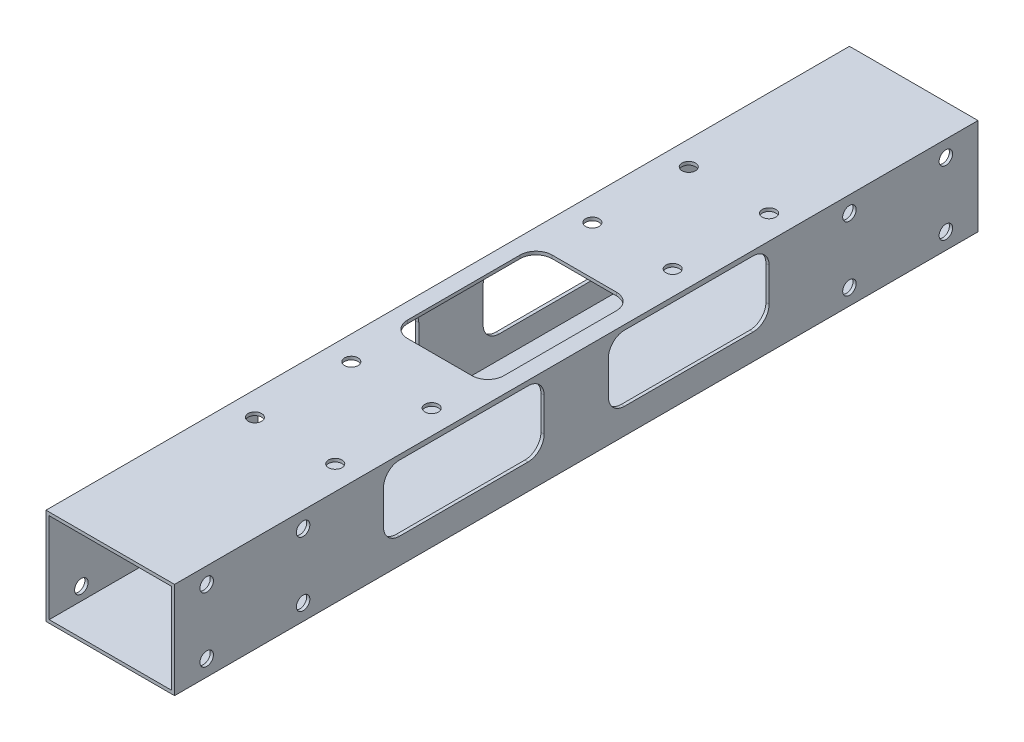
from build123d import *

# Parameters (mm, degrees)
SKETCH_1_W               = 40
SKETCH_1_H               = 30
SKETCH_1_W_2             = 38
SKETCH_1_H_2             = 28
EXTRUDE_1_DEPTH          = 250
CUT_EXTRUDE_1_DEPTH      = 252.246890528
CUT_EXTRUDE_1_DEPTH_BACK = 252.246890528
SKETCH_2_R               = 2.1
CUT_EXTRUDE_START        = 15
SKETCH_3_R               = 2.1
CUT_EXTRUDE_2_DEPTH      = 29
CUT_EXTRUDE_3_DEPTH      = 252.246890528
CUT_EXTRUDE_3_DEPTH_BACK = 252.246890528


with BuildPart() as part:
    # 草图1 → 凸台-拉伸1 (new body)
    with BuildSketch(Plane.XY):
        Rectangle(SKETCH_1_W, SKETCH_1_H)
        Rectangle(SKETCH_1_W_2, SKETCH_1_H_2, mode=Mode.SUBTRACT)
    extrude(amount=EXTRUDE_1_DEPTH)

    # 草图2 → 切除-拉伸1 (cut, two sides: drawn at the far end of the back side and taken through both)
    with BuildSketch(Plane(origin=(0, 0, 0), x_dir=(0, 0, -1), z_dir=(1, 0, 0)).offset(-CUT_EXTRUDE_1_DEPTH_BACK)):
        with Locations((-210, 10)):
            Circle(SKETCH_2_R)
        with Locations((-240, 10)):
            Circle(SKETCH_2_R)
        with Locations((-210, -10)):
            Circle(SKETCH_2_R)
        with Locations((-240, -10)):
            Circle(SKETCH_2_R)
        with Locations((-10, -10)):
            Circle(SKETCH_2_R)
        with Locations((-40, -10)):
            Circle(SKETCH_2_R)
        with Locations((-10, 10)):
            Circle(SKETCH_2_R)
        with Locations((-40, 10)):
            Circle(SKETCH_2_R)
    extrude(amount=CUT_EXTRUDE_1_DEPTH + CUT_EXTRUDE_1_DEPTH_BACK, mode=Mode.SUBTRACT)

    # 草图3 → 切除-拉伸2 (cut)
    with BuildSketch(Plane(origin=(0, 0, 0), x_dir=(1, 0, 0), z_dir=(0, 1, 0)).offset(CUT_EXTRUDE_START)):
        with Locations(Location((-12.5, -87.5, 0), (0, 0, 90))):
            Circle(SKETCH_3_R)
        with Locations(Location((12.5, -87.5, 0), (0, 0, 90))):
            Circle(SKETCH_3_R)
        with Locations(Location((-12.5, -57.5, 0), (0, 0, 90))):
            Circle(SKETCH_3_R)
        with Locations(Location((12.5, -57.5, 0), (0, 0, 90))):
            Circle(SKETCH_3_R)
        with Locations(Location((12.5, -192.5, 0), (0, 0, 90))):
            Circle(SKETCH_3_R)
        with Locations(Location((-12.5, -192.5, 0), (0, 0, 90))):
            Circle(SKETCH_3_R)
        with Locations(Location((12.5, -162.5, 0), (0, 0, 90))):
            Circle(SKETCH_3_R)
        with Locations(Location((-12.5, -162.5, 0), (0, 0, 90))):
            Circle(SKETCH_3_R)
        with BuildLine():
            Line((-10, -147.5), (10, -147.5))
            ThreePointArc((10, -147.5), (13.535533906, -146.035533906), (15, -142.5))
            Line((15, -142.5), (15, -107.5))
            ThreePointArc((15, -107.5), (13.535533906, -103.964466094), (10, -102.5))
            Line((10, -102.5), (-10, -102.5))
            ThreePointArc((-10, -102.5), (-13.535533906, -103.964466094), (-15, -107.5))
            Line((-15, -107.5), (-15, -142.5))
            ThreePointArc((-15, -142.5), (-13.535533906, -146.035533906), (-10, -147.5))
        make_face()
    extrude(amount=-CUT_EXTRUDE_2_DEPTH, mode=Mode.SUBTRACT)

    # 草图4 → 切除-拉伸3 (cut, two sides: drawn at the far end of the back side and taken through both)
    with BuildSketch(Plane(origin=(0, 0, 0), x_dir=(0, 0, -1), z_dir=(1, 0, 0)).offset(-CUT_EXTRUDE_3_DEPTH_BACK)):
        with BuildLine():
            Line((-180, -7), (-140, -7))
            ThreePointArc((-140, -7), (-136.464466094, -5.535533906), (-135, -2))
            Line((-135, -2), (-135, 8.5))
            ThreePointArc((-135, 8.5), (-136.464466094, 12.035533906), (-140, 13.5))
            Line((-140, 13.5), (-180, 13.5))
            ThreePointArc((-180, 13.5), (-183.535533906, 12.035533906), (-185, 8.5))
            Line((-185, 8.5), (-185, -2))
            ThreePointArc((-185, -2), (-183.535533906, -5.535533906), (-180, -7))
        make_face()
        with BuildLine():
            Line((-115, -2), (-115, 8.5))
            ThreePointArc((-115, 8.5), (-113.535533906, 12.035533906), (-110, 13.5))
            Line((-110, 13.5), (-70, 13.5))
            ThreePointArc((-70, 13.5), (-66.464466094, 12.035533906), (-65, 8.5))
            Line((-65, 8.5), (-65, -2))
            ThreePointArc((-65, -2), (-66.464466094, -5.535533906), (-70, -7))
            Line((-70, -7), (-110, -7))
            ThreePointArc((-110, -7), (-113.535533906, -5.535533906), (-115, -2))
        make_face()
    extrude(amount=CUT_EXTRUDE_3_DEPTH + CUT_EXTRUDE_3_DEPTH_BACK, mode=Mode.SUBTRACT)


solid = part.part
